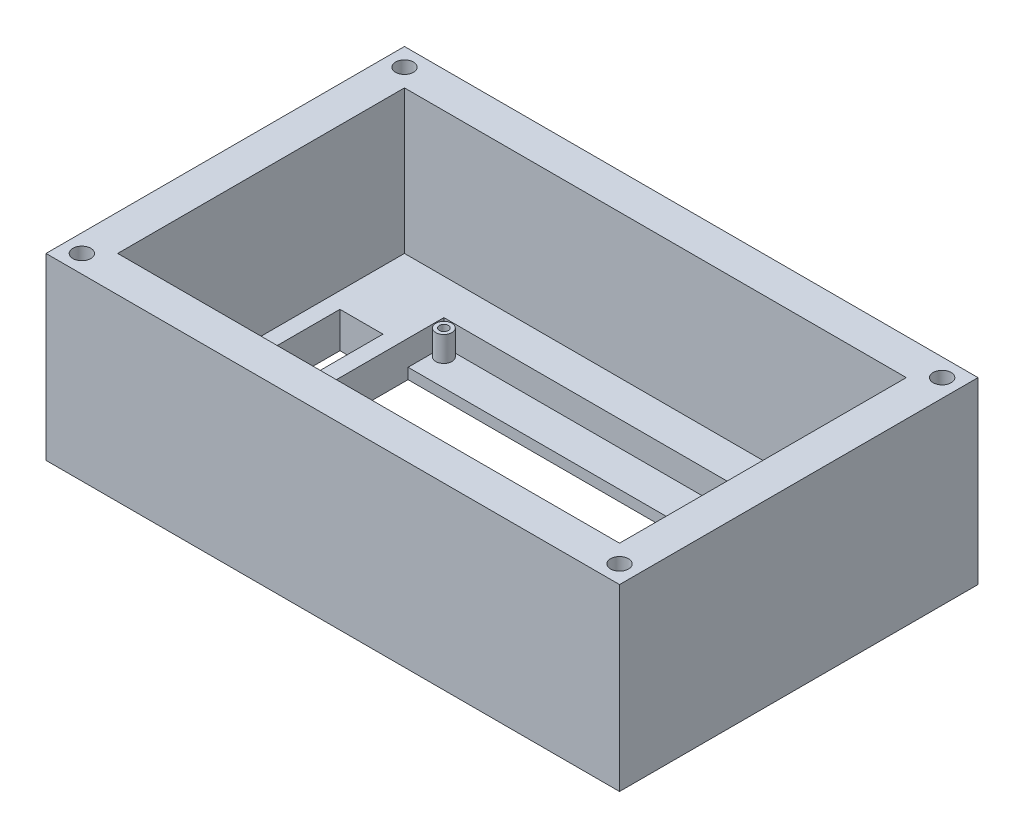
from build123d import *

# Parameters (mm, degrees)
ESQUISSE1_W             = 160
ESQUISSE1_H             = 100
BOSS_EXTRU_1_DEPTH      = 50
COQUE1_T                = -10
ESQUISSE2_R             = 2.5
ENL_V_MAT_EXTRU_2_DEPTH = 15
ESQUISSE3_W             = 98
ESQUISSE3_H             = 40
ENL_V_MAT_EXTRU_3_DEPTH = 10
ESQUISSE3_3_R           = 1.25
ENL_V_MAT_EXTRU_4_DEPTH = 10
ESQUISSE3_5_W           = 98
ESQUISSE3_5_H           = 60
ENL_V_MAT_EXTRU_5_DEPTH = 7
ESQUISSE3_6_R           = 2.25
ESQUISSE3_6_R_2         = 1.25
BOSS_EXTRU_2_DEPTH      = 7
BOSS_EXTRU_2_2_DEPTH    = 7
BOSS_EXTRU_2_3_DEPTH    = 7
BOSS_EXTRU_2_4_DEPTH    = 7
ESQUISSE4_W             = 12
ESQUISSE4_H             = 35
ENL_V_MAT_EXTRU_6_DEPTH = 10


with BuildPart() as part:
    # Esquisse1 → Boss.-Extru.1 (new body)
    with BuildSketch(Plane(origin=(0, 0, 0), x_dir=(1, 0, 0), z_dir=(0, 1, 0))):
        with Locations((80, 50)):
            Rectangle(ESQUISSE1_W, ESQUISSE1_H)
    extrude(amount=BOSS_EXTRU_1_DEPTH)

    # Coque1
    coque1_openings = [part.faces().sort_by_distance(p)[0] for p in [
        (80, 50, -50),
    ]]
    offset(amount=COQUE1_T, openings=coque1_openings, kind=Kind.INTERSECTION)

    # Esquisse2 → Enlèv. mat.-Extru.2 (cut)
    with BuildSketch(Plane(origin=(0, 50, 0), x_dir=(1, 0, 0), z_dir=(0, 1, 0))):
        with Locations((155, 95)):
            Circle(ESQUISSE2_R)
        with Locations((155, 5)):
            Circle(ESQUISSE2_R)
        with Locations((5, 5)):
            Circle(ESQUISSE2_R)
        with Locations((5, 95)):
            Circle(ESQUISSE2_R)
    extrude(amount=-ENL_V_MAT_EXTRU_2_DEPTH, mode=Mode.SUBTRACT)

    # Esquisse3 → Enlèv. mat.-Extru.3 (cut)
    with BuildSketch(Plane(origin=(0, 10, 0), x_dir=(1, 0, 0), z_dir=(0, 1, 0))):
        with Locations((80, 50)):
            Rectangle(ESQUISSE3_W, ESQUISSE3_H)
    extrude(amount=-ENL_V_MAT_EXTRU_3_DEPTH, mode=Mode.SUBTRACT)

    # Esquisse3<3> → Enlèv. mat.-Extru.4 (cut)
    with BuildSketch(Plane(origin=(0, 10, 0), x_dir=(1, 0, 0), z_dir=(0, 1, 0))):
        with Locations((33.5, 77.5)):
            Circle(ESQUISSE3_3_R)
        with Locations((33.5, 22.5)):
            Circle(ESQUISSE3_3_R)
        with Locations((126.5, 77.5)):
            Circle(ESQUISSE3_3_R)
        with Locations((126.5, 22.5)):
            Circle(ESQUISSE3_3_R)
    extrude(amount=-ENL_V_MAT_EXTRU_4_DEPTH, mode=Mode.SUBTRACT)

    # Esquisse3<5> → Enlèv. mat.-Extru.5 (cut)
    with BuildSketch(Plane(origin=(0, 10, 0), x_dir=(1, 0, 0), z_dir=(0, 1, 0))):
        with Locations((80, 50)):
            Rectangle(ESQUISSE3_5_W, ESQUISSE3_5_H)
    extrude(amount=-ENL_V_MAT_EXTRU_5_DEPTH, mode=Mode.SUBTRACT)

    # Esquisse4 → Enlèv. mat.-Extru.6 (cut)
    with BuildSketch(Plane(origin=(0, 10, 0), x_dir=(1, 0, 0), z_dir=(0, 1, 0))):
        with Locations((20.5, 50)):
            Rectangle(ESQUISSE4_W, ESQUISSE4_H)
        with Locations((139.5, 50)):
            Rectangle(ESQUISSE4_W, ESQUISSE4_H)
    extrude(amount=-ENL_V_MAT_EXTRU_6_DEPTH, mode=Mode.SUBTRACT)


with BuildPart() as body_2:
    # Esquisse3<6> → Boss.-Extru.2 (new body)
    with BuildSketch(Plane(origin=(0, 10, 0), x_dir=(1, 0, 0), z_dir=(0, 1, 0))):
        with Locations((33.5, 77.5)):
            Circle(ESQUISSE3_6_R)
        with Locations((33.5, 77.5)):
            Circle(ESQUISSE3_6_R_2, mode=Mode.SUBTRACT)
    extrude(amount=-BOSS_EXTRU_2_DEPTH)


with BuildPart() as body_3:
    # Esquisse3<6> → Boss.-Extru.2 2 (new body)
    with BuildSketch(Plane(origin=(0, 10, 0), x_dir=(1, 0, 0), z_dir=(0, 1, 0))):
        with Locations((126.5, 77.5)):
            Circle(ESQUISSE3_6_R)
        with Locations((126.5, 77.5)):
            Circle(ESQUISSE3_6_R_2, mode=Mode.SUBTRACT)
    extrude(amount=-BOSS_EXTRU_2_2_DEPTH)


with BuildPart() as body_4:
    # Esquisse3<6> → Boss.-Extru.2 3 (new body)
    with BuildSketch(Plane(origin=(0, 10, 0), x_dir=(1, 0, 0), z_dir=(0, 1, 0))):
        with Locations((126.5, 22.5)):
            Circle(ESQUISSE3_6_R)
        with Locations((126.5, 22.5)):
            Circle(ESQUISSE3_6_R_2, mode=Mode.SUBTRACT)
    extrude(amount=-BOSS_EXTRU_2_3_DEPTH)


with BuildPart() as body_5:
    # Esquisse3<6> → Boss.-Extru.2 4 (new body)
    with BuildSketch(Plane(origin=(0, 10, 0), x_dir=(1, 0, 0), z_dir=(0, 1, 0))):
        with Locations((33.5, 22.5)):
            Circle(ESQUISSE3_6_R)
        with Locations((33.5, 22.5)):
            Circle(ESQUISSE3_6_R_2, mode=Mode.SUBTRACT)
    extrude(amount=-BOSS_EXTRU_2_4_DEPTH)


solid = Compound([part.part, body_2.part, body_3.part, body_4.part, body_5.part])
